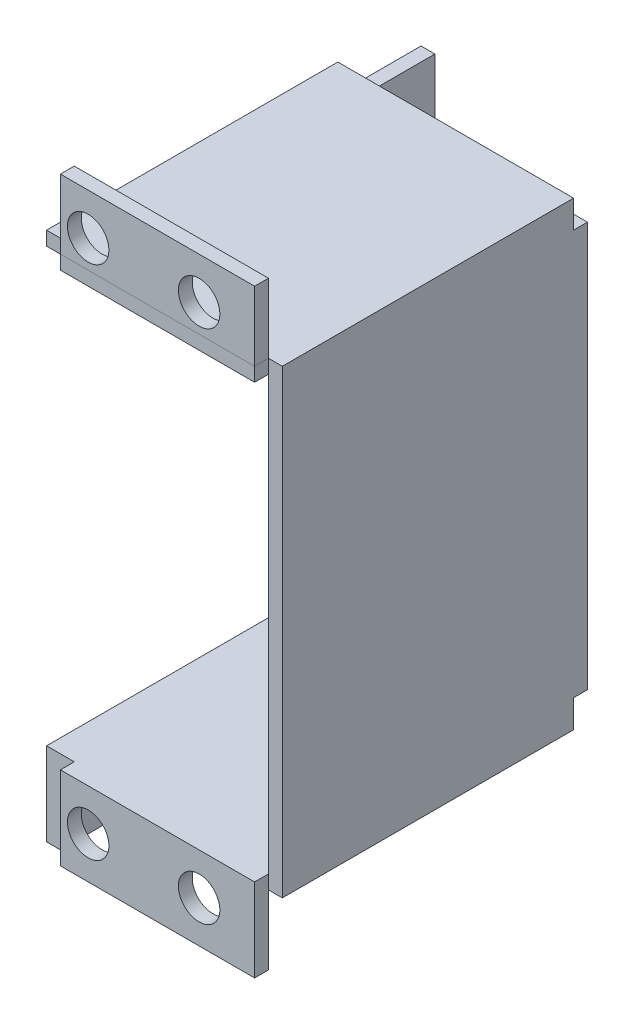
from build123d import *

# Parameters (mm, degrees)
EXTRUDE_THIN1_DEPTH            = 26.67
F_6_CLEARANCE_HOLE4_D          = 3.7973
F_6_CLEARANCE_HOLE4_DEPTH      = 7.62
F_6_CLEARANCE_HOLE4_TIP        = 1.140824014
SKETCH4_W                      = 17.78
SKETCH4_H                      = 1.27
BOSS_EXTRUDE1_DEPTH            = 6.35
SKETCH7_W                      = 17.78
SKETCH7_H                      = 1.27
BOSS_EXTRUDE2_DEPTH            = 1.27
SKETCH5_W                      = 1.89865
SKETCH5_H                      = 1.270025
F_6_CLEARANCE_HOLE2_AT_2_COUNT = 2
F_6_CLEARANCE_HOLE2_AT_2_PITCH = 10.16
SKETCH8_W                      = 17.78
SKETCH8_H                      = 1.27
BOSS_EXTRUDE3_DEPTH            = 1.27
SKETCH9_W                      = 17.78
SKETCH9_H                      = 1.27
BOSS_EXTRUDE4_DEPTH            = 6.35
F_6_CLEARANCE_HOLE3_AT_2_COUNT = 2
F_6_CLEARANCE_HOLE3_AT_2_PITCH = 10.16
SKETCH15_W                     = 1.27
SKETCH15_H                     = 37.084
BOSS_EXTRUDE5_DEPTH            = 1.27
SKETCH17_W                     = 1.27
SKETCH17_H                     = 37.084
BOSS_EXTRUDE14_DEPTH           = 20.32
SKETCH18_W                     = 1.27
SKETCH18_H                     = 37.084
BOSS_EXTRUDE15_DEPTH           = 6.35
F_6_CLEARANCE_HOLE5_AT_2_COUNT = 2
F_6_CLEARANCE_HOLE5_AT_2_PITCH = 21.844


with BuildPart() as part:
    # Sketch1 → Extrude-Thin1 (new body)
    with BuildSketch(Plane.XY):
        Polygon((0, 0), (20.32, 0), (20.32, -39.624), (0, -39.624), (0, -47.244), (1.27, -47.244), (1.27, -40.894), (21.59, -40.894), (21.59, 1.27), (0, 1.27), align=None)
    extrude(amount=EXTRUDE_THIN1_DEPTH)

    # #6 Clearance Hole4
    with Locations(Plane(origin=(1.27, 0, 0), x_dir=(0, 0, -1), z_dir=(1, 0, 0))):
        with Locations((-21.59, -44.069), (-5.08, -44.069)):
            Hole(F_6_CLEARANCE_HOLE4_D / 2, depth=F_6_CLEARANCE_HOLE4_DEPTH)
            with Locations((0, 0, -(F_6_CLEARANCE_HOLE4_DEPTH + F_6_CLEARANCE_HOLE4_TIP / 2))):  # 118° drill point
                Cone(0, F_6_CLEARANCE_HOLE4_D / 2, F_6_CLEARANCE_HOLE4_TIP, mode=Mode.SUBTRACT)

    # Sketch7 → Boss-Extrude2 (add)
    with BuildSketch(Plane.XY.offset(26.67)):
        with Locations((11.43, 0.635)):
            Rectangle(SKETCH7_W, SKETCH7_H)
    extrude(amount=BOSS_EXTRUDE2_DEPTH)

    # Sketch8 → Boss-Extrude3 (add)
    with BuildSketch(Plane.XY.offset(26.67)):
        with Locations((11.43, -40.259)):
            Rectangle(SKETCH8_W, SKETCH8_H)
    extrude(amount=BOSS_EXTRUDE3_DEPTH)

    # Sketch9 → Boss-Extrude4 (add)
    with BuildSketch(Plane.XZ.offset(40.894)):
        with Locations((11.43, 27.305)):
            Rectangle(SKETCH9_W, SKETCH9_H)
    extrude(amount=BOSS_EXTRUDE4_DEPTH)

    # Sketch10 → #6 Clearance Hole3 (revolve, cut)
    with BuildSketch(Plane(origin=(15.24, -43.434, 27.94), x_dir=(0, -1, 0), z_dir=(1, 0, 0))):
        Polygon((0, 0), (0, 4.950824014), (1.89865, 3.81), (1.89865, 0), align=None)
    f_6_clearance_hole3 = revolve(axis=Axis((15.24, -43.434, 34.29), (0, 0, -1)), mode=Mode.SUBTRACT)

    # #6 Clearance Hole3 at 2: #6 Clearance Hole3 ×2
    with Locations(*[(-i * F_6_CLEARANCE_HOLE3_AT_2_PITCH, 0, 0) for i in range(1, F_6_CLEARANCE_HOLE3_AT_2_COUNT)]):
        add(f_6_clearance_hole3, mode=Mode.SUBTRACT)

    # Sketch15 → Boss-Extrude5 (add)
    with BuildSketch(Plane(origin=(0, 0, 0), x_dir=(-1, 0, 0), z_dir=(0, 0, -1))):
        with Locations((-20.955, -19.812)):
            Rectangle(SKETCH15_W, SKETCH15_H)
    extrude(amount=BOSS_EXTRUDE5_DEPTH)

    # Sketch17 → Boss-Extrude14 (add)
    with BuildSketch(Plane.ZY.offset(-20.32)):
        with Locations((-0.635, -19.812)):
            Rectangle(SKETCH17_W, SKETCH17_H)
    extrude(amount=BOSS_EXTRUDE14_DEPTH)

    # Sketch18 → Boss-Extrude15 (add)
    with BuildSketch(Plane(origin=(0, 0, -1.27), x_dir=(-1, 0, 0), z_dir=(0, 0, -1))):
        with Locations((-0.635, -19.812)):
            Rectangle(SKETCH18_W, SKETCH18_H)
    extrude(amount=BOSS_EXTRUDE15_DEPTH)

    # Sketch19 → #6 Clearance Hole5 (revolve, cut)
    with BuildSketch(Plane(origin=(1.27, -8.89, -4.445), x_dir=(0, 0, -1), z_dir=(0, 1, 0))):
        Polygon((0, 0), (0, 8.760824014), (1.89865, 7.62), (1.89865, 0), align=None)
    f_6_clearance_hole5 = revolve(axis=Axis((7.62, -8.89, -4.445), (-1, 0, 0)), mode=Mode.SUBTRACT)

    # #6 Clearance Hole5 at 2: #6 Clearance Hole5 ×2
    with Locations(*[(0, -i * F_6_CLEARANCE_HOLE5_AT_2_PITCH, 0) for i in range(1, F_6_CLEARANCE_HOLE5_AT_2_COUNT)]):
        add(f_6_clearance_hole5, mode=Mode.SUBTRACT)


with BuildPart() as body_2:
    # Sketch4 → Boss-Extrude1 (new body)
    with BuildSketch(Plane(origin=(0, 1.27, 0), x_dir=(1, 0, 0), z_dir=(0, 1, 0))):
        with Locations((11.43, -27.305)):
            Rectangle(SKETCH4_W, SKETCH4_H)
    extrude(amount=BOSS_EXTRUDE1_DEPTH)

    # Sketch5 → #6 Clearance Hole2 (revolve, cut)
    with BuildSketch(Plane(origin=(5.08, 3.81, 26.67), x_dir=(0, 1, 0), z_dir=(1, 0, 0))):
        with Locations((0.949325, 0.6350125)):
            Rectangle(SKETCH5_W, SKETCH5_H)
    f_6_clearance_hole2 = revolve(axis=Axis((5.08, 3.81, 20.32), (0, 0, 1)), mode=Mode.SUBTRACT)

    # #6 Clearance Hole2 at 2: #6 Clearance Hole2 ×2
    with Locations(*[(i * F_6_CLEARANCE_HOLE2_AT_2_PITCH, 0, 0) for i in range(1, F_6_CLEARANCE_HOLE2_AT_2_COUNT)]):
        add(f_6_clearance_hole2, mode=Mode.SUBTRACT)


solid = Compound([part.part, body_2.part])
